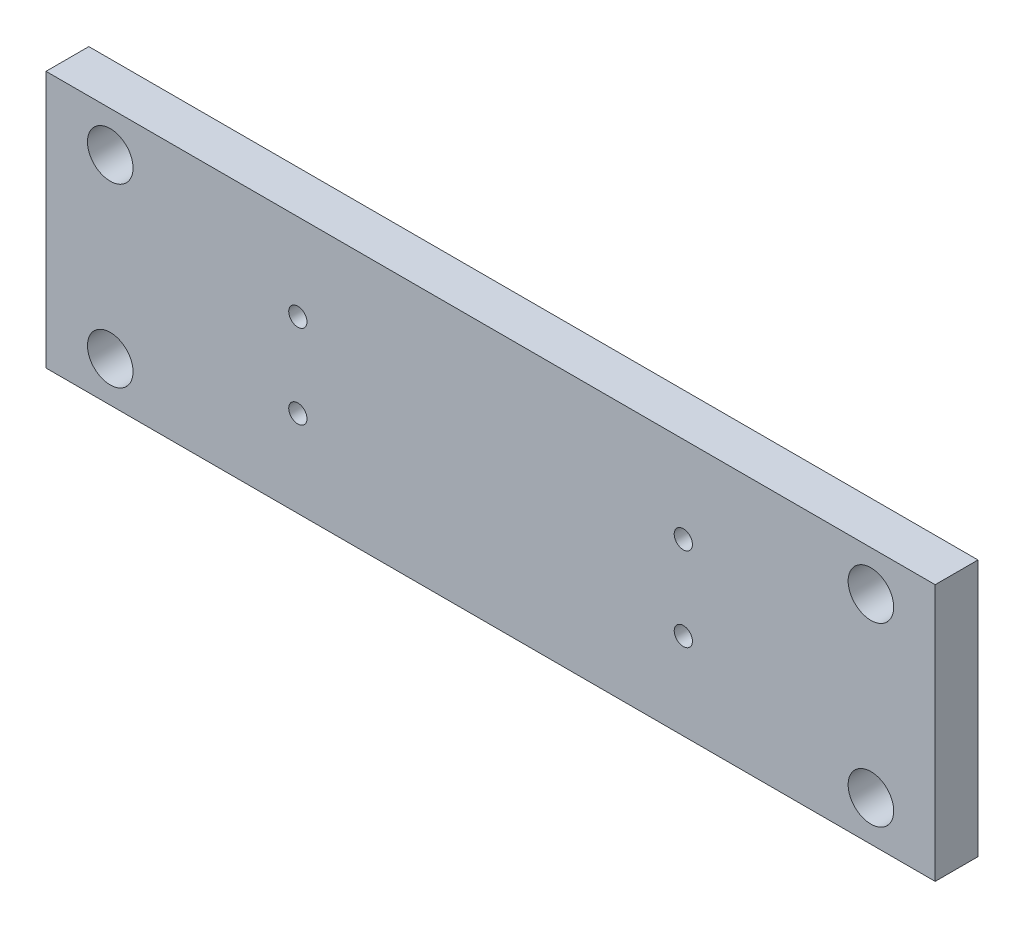
from build123d import *

# Parameters (mm, degrees)
SKETCH1_W               = 131.826
SKETCH1_H               = 38.1
BOSS_EXTRUDE1_DEPTH     = 6.35
F_1_4_CLEARANCE_HOLE1_D = 6.7564
F_6_32_TAPPED_HOLE1_D   = 2.7051


with BuildPart() as part:
    # Sketch1 → Boss-Extrude1 (new body)
    with BuildSketch(Plane.XY):
        Rectangle(SKETCH1_W, SKETCH1_H)
    extrude(amount=BOSS_EXTRUDE1_DEPTH)

    # 1/4 Clearance Hole1 (through all)
    with Locations(Plane.XY.offset(6.35)):
        with Locations((-56.388, 13.081), (-56.388, -13.081)):
            f_1_4_clearance_hole1 = Hole(F_1_4_CLEARANCE_HOLE1_D / 2)

    # #6-32 Tapped Hole1 (through all)
    with Locations(Plane.XY.offset(6.35)):
        with Locations((-28.575, 6.2103), (-28.575, -6.2103)):
            f_6_32_tapped_hole1 = Hole(F_6_32_TAPPED_HOLE1_D / 2)

    # Mirror1: 1/4 Clearance Hole1, #6-32 Tapped Hole1 across plane
    add(f_1_4_clearance_hole1.mirror(Plane(origin=(0, 0, 0), x_dir=(0, 0, 1), z_dir=(1, 0, 0))), mode=Mode.SUBTRACT)
    add(f_6_32_tapped_hole1.mirror(Plane(origin=(0, 0, 0), x_dir=(0, 0, 1), z_dir=(1, 0, 0))), mode=Mode.SUBTRACT)


solid = part.part
